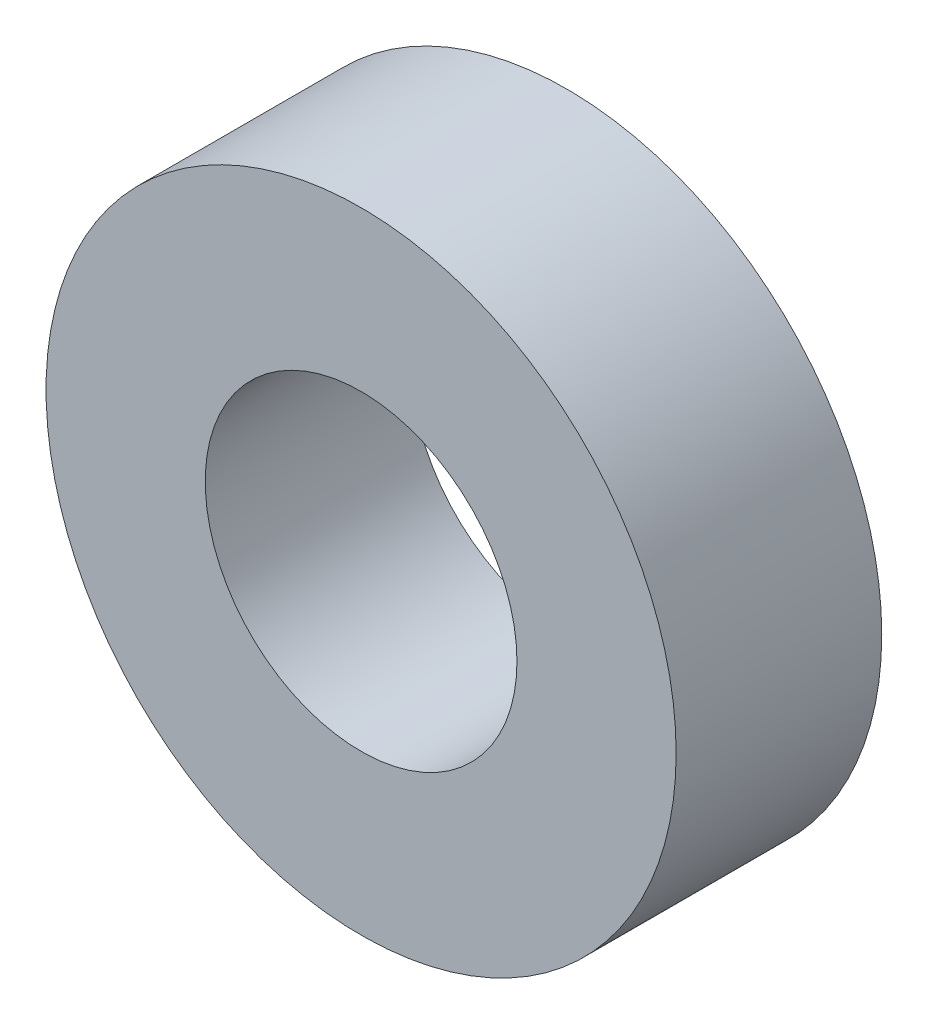
from build123d import *

# Parameters (mm, degrees)
SKETCH1_R           = 4.75
BOSS_EXTRUDE1_DEPTH = 1.55
SKETCH2_R           = 2.35
CUT_EXTRUDE1_DEPTH  = 8.398310618


with BuildPart() as part:
    # Sketch1 → Boss-Extrude1 (new, symmetric)
    with BuildSketch(Plane.XY):
        Circle(SKETCH1_R)
    extrude(amount=BOSS_EXTRUDE1_DEPTH, both=True)

    # Sketch2 → Cut-Extrude1 (cut, through all)
    with BuildSketch(Plane.XY.offset(1.55)):
        Circle(SKETCH2_R)
    extrude(amount=-CUT_EXTRUDE1_DEPTH, mode=Mode.SUBTRACT)


solid = part.part
